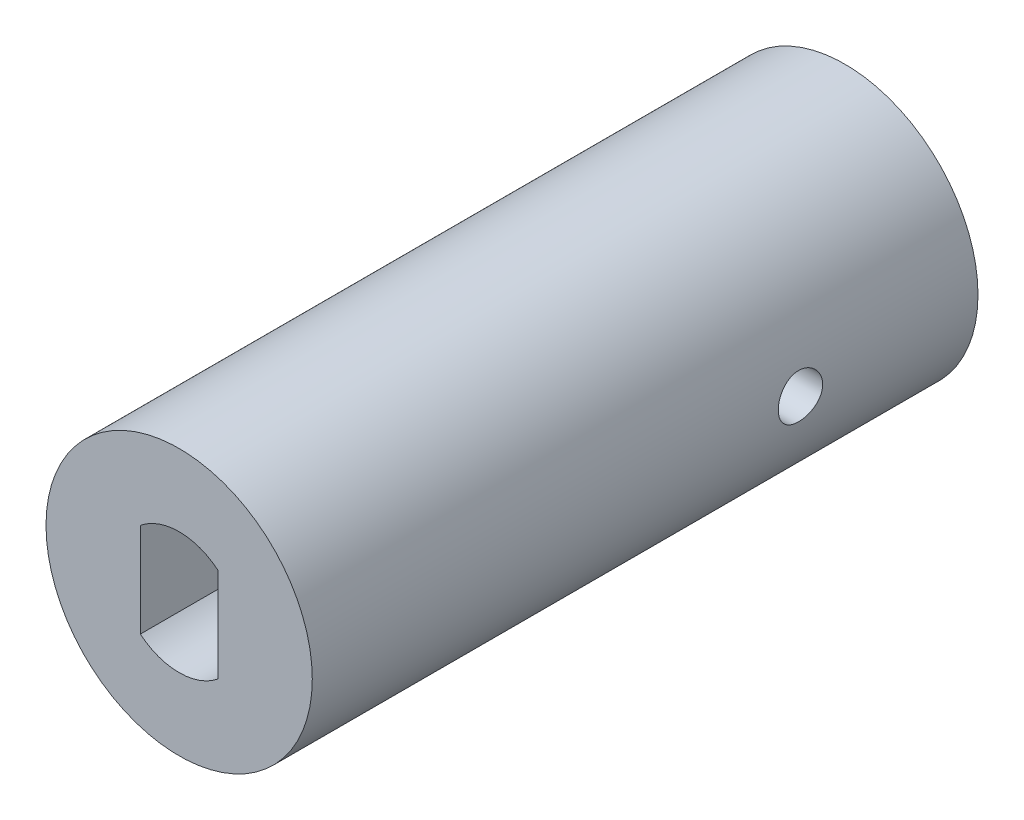
from build123d import *

# Parameters (mm, degrees)
CROQUIS1_R                 = 6
SALIENTE_EXTRUIR1_DEPTH    = 30
CROQUIS2_R                 = 4
CORTAR_EXTRUIR1_DEPTH      = 15
CROQUIS3_W                 = 3.5
CROQUIS3_H                 = 4.242640688
CORTAR_EXTRUIR2_DEPTH      = 7
CORTAR_EXTRUIR3_DEPTH      = 32.176914536
CORTAR_EXTRUIR3_DEPTH_BACK = 32.176914536
CROQUIS4_R                 = 1


with BuildPart() as part:
    # Croquis1 → Saliente-Extruir1 (new body)
    with BuildSketch(Plane.XY):
        Circle(CROQUIS1_R)
    extrude(amount=SALIENTE_EXTRUIR1_DEPTH)

    # Croquis2 → Cortar-Extruir1 (cut)
    with BuildSketch(Plane(origin=(0, 0, 0), x_dir=(-1, 0, 0), z_dir=(0, 0, -1))):
        Circle(CROQUIS2_R)
    extrude(amount=-CORTAR_EXTRUIR1_DEPTH, mode=Mode.SUBTRACT)

    # Croquis3 → Cortar-Extruir2 (cut)
    with BuildSketch(Plane.XY.offset(30)):
        Rectangle(CROQUIS3_W, CROQUIS3_H)
        with BuildLine():
            ThreePointArc((1.75, 2.121320344), (0, 2.75), (-1.75, 2.121320344))
            Line((-1.75, 2.121320344), (1.75, 2.121320344))
        make_face()
        with BuildLine():
            Line((1.75, -2.121320344), (-1.75, -2.121320344))
            ThreePointArc((-1.75, -2.121320344), (0, -2.75), (1.75, -2.121320344))
        make_face()
    extrude(amount=-CORTAR_EXTRUIR2_DEPTH, mode=Mode.SUBTRACT)

    # Croquis4 → Cortar-Extruir3 (cut, two sides: drawn at the far end of the back side and taken through both)
    with BuildSketch(Plane(origin=(0, 0, 0), x_dir=(0, 0, -1), z_dir=(1, 0, 0)).offset(-CORTAR_EXTRUIR3_DEPTH_BACK)):
        with Locations((-8, 0)):
            Circle(CROQUIS4_R)
    extrude(amount=CORTAR_EXTRUIR3_DEPTH + CORTAR_EXTRUIR3_DEPTH_BACK, mode=Mode.SUBTRACT)


solid = part.part
